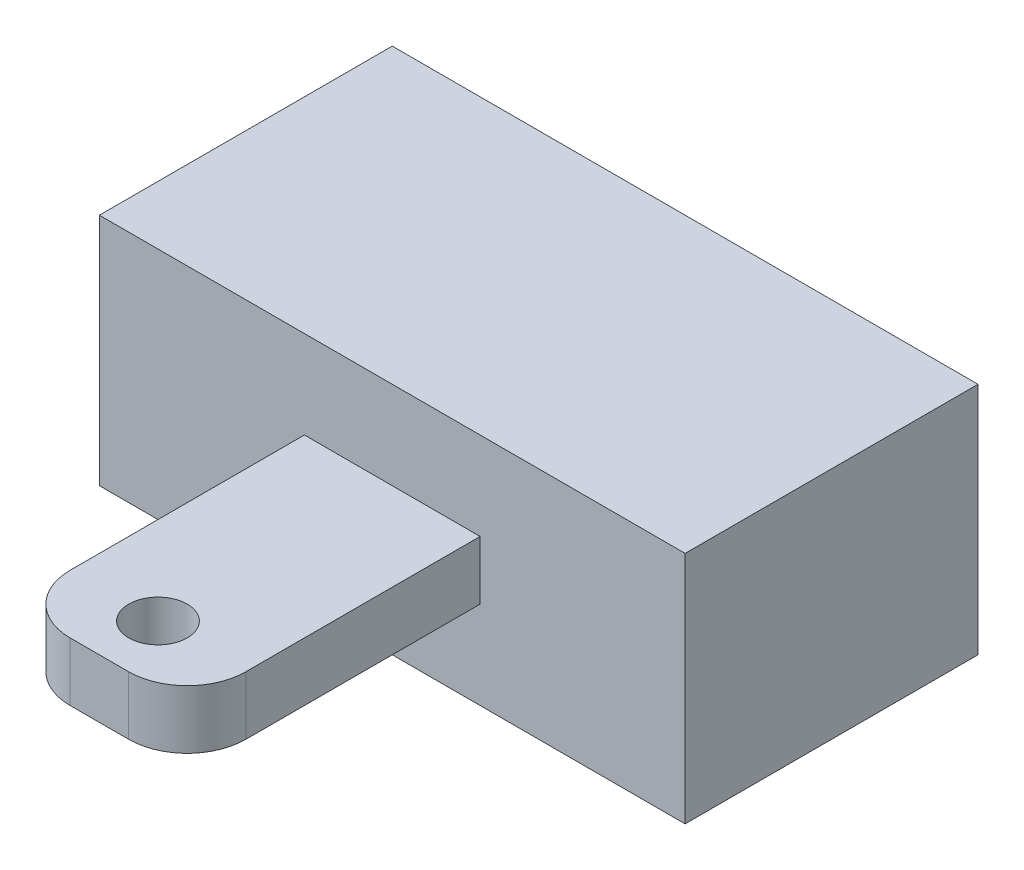
from build123d import *

# Parameters (mm, degrees)
SKETCH1_W           = 30
SKETCH1_H           = 100
BOSS_EXTRUDE1_DEPTH = 10
SKETCH2_R           = 5
CUT_EXTRUDE1_DEPTH  = 10
SKETCH3_W           = 100
SKETCH3_H           = 40
BOSS_EXTRUDE2_DEPTH = 50
FILLET1_R           = 10


with BuildPart() as part:
    # Sketch1 → Boss-Extrude1 (new body)
    with BuildSketch(Plane(origin=(0, 0, 0), x_dir=(1, 0, 0), z_dir=(0, 1, 0))):
        Rectangle(SKETCH1_W, SKETCH1_H)
    extrude(amount=BOSS_EXTRUDE1_DEPTH)

    # Sketch2 → Cut-Extrude1 (cut)
    with BuildSketch(Plane(origin=(0, 10, 0), x_dir=(1, 0, 0), z_dir=(0, 1, 0))):
        with Locations(Location((0, -40, 0), (0, 0, 270))):
            Circle(SKETCH2_R)
    extrude(amount=-CUT_EXTRUDE1_DEPTH, mode=Mode.SUBTRACT)

    # Sketch3 → Boss-Extrude2 (add)
    with BuildSketch(Plane(origin=(0, 0, -50), x_dir=(-1, 0, 0), z_dir=(0, 0, -1))):
        with Locations((0, 5)):
            Rectangle(SKETCH3_W, SKETCH3_H)
    extrude(amount=-BOSS_EXTRUDE2_DEPTH)

    # Fillet1
    fillet1_edges = [part.edges().sort_by_distance(p)[0] for p in [
        (15, 5, 50),
        (-15, 5, 50),
    ]]
    fillet(fillet1_edges, radius=FILLET1_R)


solid = part.part
